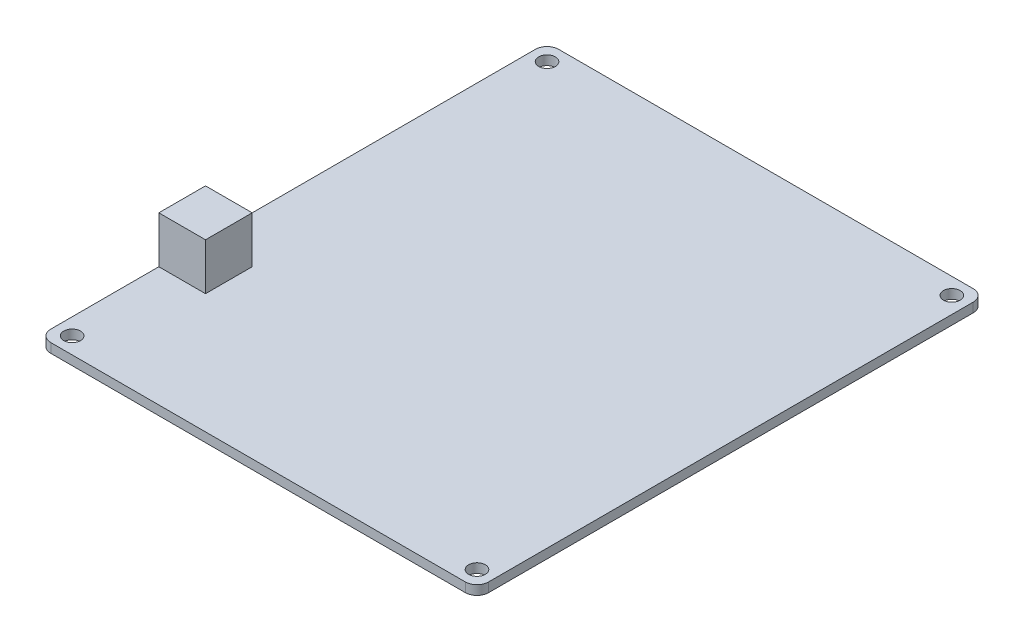
from build123d import *

# Parameters (mm, degrees)
SKETCH1_W                                  = 75
SKETCH1_H                                  = 87
BOSS_EXTRUDE1_DEPTH                        = 1.6
SKETCH2_R                                  = 1.43
CUT_EXTRUDE1_DEPTH                         = 58.45485184
MIRROR1_AT_THE_SECOND_PLANE_COPY_1_SKETC_R = 1.43
MIRROR1_AT_THE_SECOND_PLANE_COPY_1_DEPTH   = 58.45485184
FILLET1_R                                  = 2
SKETCH3_W                                  = 8
SKETCH3_H                                  = 8
BOSS_EXTRUDE2_DEPTH                        = 8


with BuildPart() as part:
    # Sketch1 → Boss-Extrude1 (new body)
    with BuildSketch(Plane(origin=(0, 0, 0), x_dir=(1, 0, 0), z_dir=(0, 1, 0))):
        Rectangle(SKETCH1_W, SKETCH1_H)
    extrude(amount=BOSS_EXTRUDE1_DEPTH)

    # Sketch2 → Cut-Extrude1 (cut, through all)
    with BuildSketch(Plane(origin=(0, 1.6, 0), x_dir=(1, 0, 0), z_dir=(0, 1, 0))):
        with Locations(Location((-34.67, 40.67, 0), (0, 0, 270))):
            Circle(SKETCH2_R)
    cut_extrude1 = extrude(amount=-CUT_EXTRUDE1_DEPTH, mode=Mode.SUBTRACT)

    # Mirror1: Cut-Extrude1 across plane
    add(cut_extrude1.mirror(Plane.XY), mode=Mode.SUBTRACT)

    # Mirror1 at the second plane: Cut-Extrude1 across plane
    add(cut_extrude1.mirror(Plane(origin=(0, 0, 0), x_dir=(0, 0, 1), z_dir=(1, 0, 0))), mode=Mode.SUBTRACT)

    # Mirror1 at the second plane copy 1 sketc → Mirror1 at the second plane copy 1 (cut, through all)
    with BuildSketch(Plane(origin=(0, 1.6, 0), x_dir=(-1, 0, 0), z_dir=(0, 1, 0))):
        with Locations(Location((-34.67, 40.67, 0), (0, 0, 270))):
            Circle(MIRROR1_AT_THE_SECOND_PLANE_COPY_1_SKETC_R)
    extrude(amount=-MIRROR1_AT_THE_SECOND_PLANE_COPY_1_DEPTH, mode=Mode.SUBTRACT)

    # Fillet1
    fillet1_edges = [part.edges().sort_by_distance(p)[0] for p in [
        (-37.5, 0.8, 43.5),
        (-37.5, 0.8, -43.5),
        (37.5, 0.8, -43.5),
        (37.5, 0.8, 43.5),
    ]]
    fillet(fillet1_edges, radius=FILLET1_R)

    # Sketch3 → Boss-Extrude2 (add)
    with BuildSketch(Plane(origin=(0, 1.6, 0), x_dir=(1, 0, 0), z_dir=(0, 1, 0))):
        with Locations((-33.5, -19)):
            Rectangle(SKETCH3_W, SKETCH3_H)
    extrude(amount=BOSS_EXTRUDE2_DEPTH)


solid = part.part
